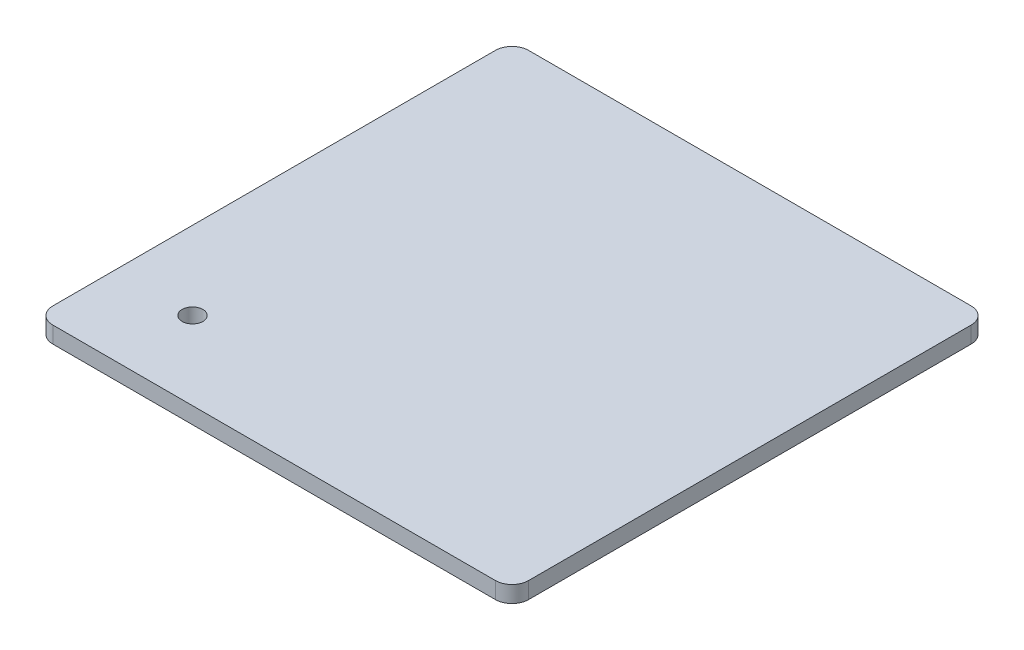
from build123d import *

# Parameters (mm, degrees)
SKETCH1_W           = 91.35
SKETCH1_H           = 91.35
BOSS_EXTRUDE1_DEPTH = 3.175
SKETCH2_R           = 2
CUT_EXTRUDE1_DEPTH  = 130.22741824
FILLET1_R           = 3.175


with BuildPart() as part:
    # Sketch1 → Boss-Extrude1 (new body)
    with BuildSketch(Plane(origin=(0, 0, 0), x_dir=(1, 0, 0), z_dir=(0, 1, 0))):
        with Locations((45.675, 45.675)):
            Rectangle(SKETCH1_W, SKETCH1_H)
    extrude(amount=BOSS_EXTRUDE1_DEPTH)

    # Sketch2 → Cut-Extrude1 (cut, through all)
    with BuildSketch(Plane(origin=(0, 3.175, 0), x_dir=(1, 0, 0), z_dir=(0, 1, 0))):
        with Locations(Location((15, 15, 0), (0, 0, 270))):
            Circle(SKETCH2_R)
    extrude(amount=-CUT_EXTRUDE1_DEPTH, mode=Mode.SUBTRACT)

    # Fillet1
    fillet1_edges = [part.edges().sort_by_distance(p)[0] for p in [
        (0, 1.5875, -91.35),
        (91.35, 1.5875, -91.35),
        (91.35, 1.5875, 0),
        (0, 1.5875, 0),
    ]]
    fillet(fillet1_edges, radius=FILLET1_R)


solid = part.part
